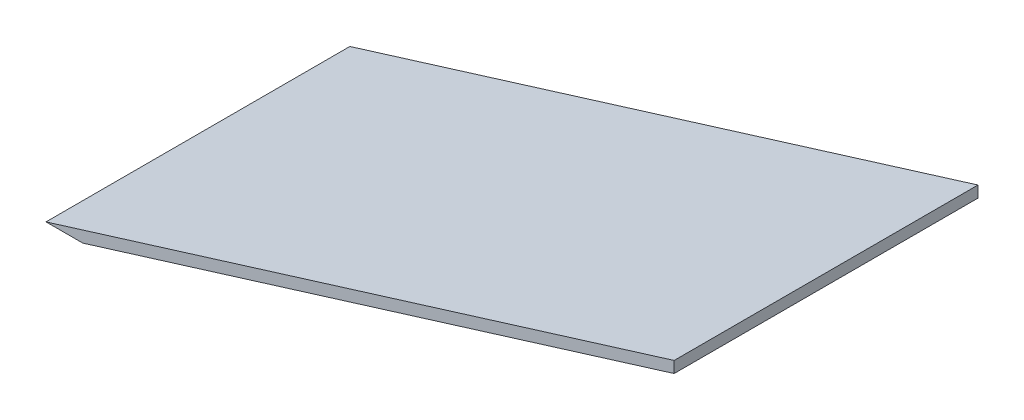
from build123d import *

# Parameters (mm, degrees)
BOSS_EXTRUDE1_DEPTH = 490


with BuildPart() as part:
    # Sketch1 → Boss-Extrude1 (new body)
    with BuildSketch(Plane.XY):
        Polygon((0, 0), (1013, 313), (1013, 294.683671761), (59.27936264, 0), align=None)
    extrude(amount=BOSS_EXTRUDE1_DEPTH)


solid = part.part
